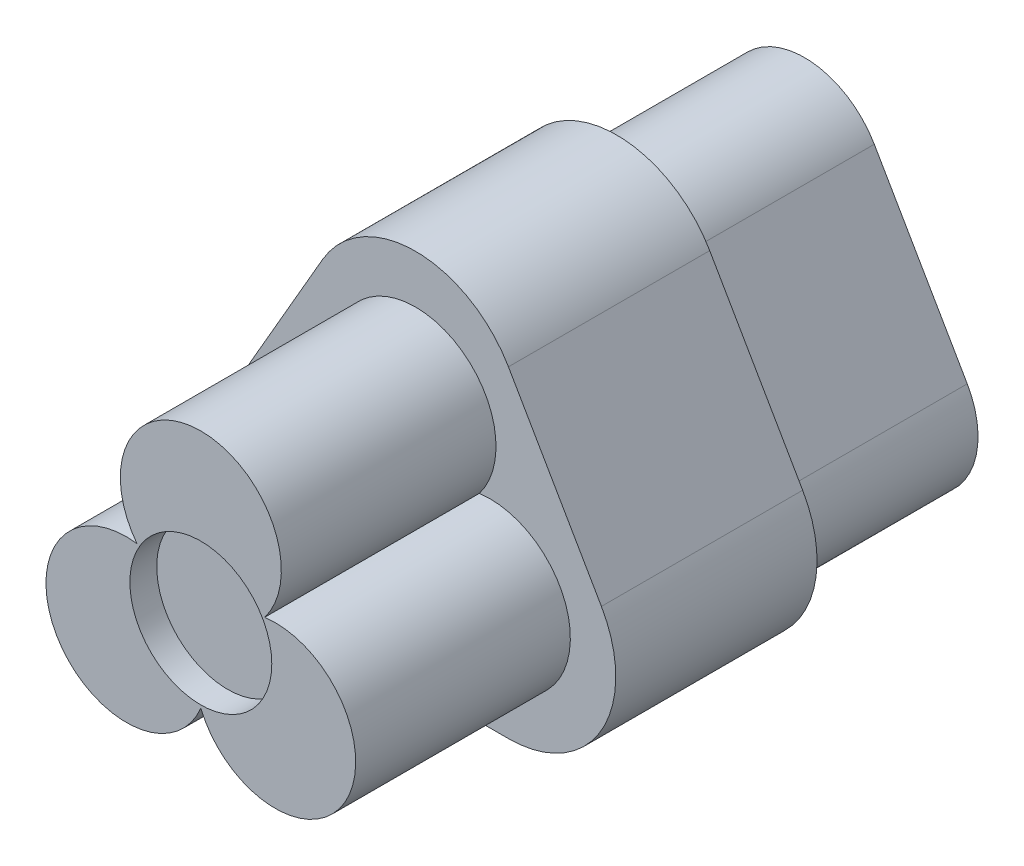
from build123d import *

# Parameters (mm, degrees)
EXTRUDE_1_DEPTH     = 7
EXTRUDE_2_DEPTH     = 7.5
EXTRUDE_3_DEPTH     = 8
SKETCH_4_R          = 2.644424532
CUT_EXTRUDE_1_DEPTH = 1


with BuildPart() as part:
    # ｽｹｯﾁ1 → ﾎﾞｽ - 押し出し1 (new body)
    with BuildSketch(Plane.XY):
        with BuildLine():
            Line((-2.598076211, 5.5), (-6.062177826, -0.5))
            ThreePointArc((-6.062177826, -0.5), (-6.062177826, -3.5), (-3.464101615, -5))
            Line((-3.464101615, -5), (3.464101615, -5))
            ThreePointArc((3.464101615, -5), (6.062177826, -3.5), (6.062177826, -0.5))
            Line((6.062177826, -0.5), (2.598076211, 5.5))
            ThreePointArc((2.598076211, 5.5), (0, 7), (-2.598076211, 5.5))
        make_face()
    extrude(amount=EXTRUDE_1_DEPTH)

    # ｽｹｯﾁ2 → ﾎﾞｽ - 押し出し2 (add)
    with BuildSketch(Plane.XY.offset(7)):
        with BuildLine():
            Line((6.92820323, 0), (3.464101615, 6))
            ThreePointArc((3.464101615, 6), (0, 8), (-3.464101615, 6))
            Line((-3.464101615, 6), (-6.92820323, 0))
            ThreePointArc((-6.92820323, 0), (-6.92820323, -4), (-3.464101615, -6))
            Line((-3.464101615, -6), (3.464101615, -6))
            ThreePointArc((3.464101615, -6), (6.92820323, -4), (6.92820323, 0))
        make_face()
    extrude(amount=EXTRUDE_2_DEPTH)

    # ｽｹｯﾁ3 → ﾎﾞｽ - 押し出し3 (add)
    with BuildSketch(Plane.XY.offset(14.5)):
        with BuildLine():
            ThreePointArc((-2.380628083, 1.374456265), (-5.369357503, -3.1), (0, -2.748912529))
            ThreePointArc((0, -2.748912529), (5.369357503, -3.1), (2.380628083, 1.374456265))
            ThreePointArc((2.380628083, 1.374456265), (0, 6.2), (-2.380628083, 1.374456265))
        make_face()
    extrude(amount=EXTRUDE_3_DEPTH)

    # ｽｹｯﾁ4 → ｶｯﾄ - 押し出し1 (cut)
    with BuildSketch(Plane.XY.offset(22.5)):
        Circle(SKETCH_4_R)
    extrude(amount=-CUT_EXTRUDE_1_DEPTH, mode=Mode.SUBTRACT)


solid = part.part
